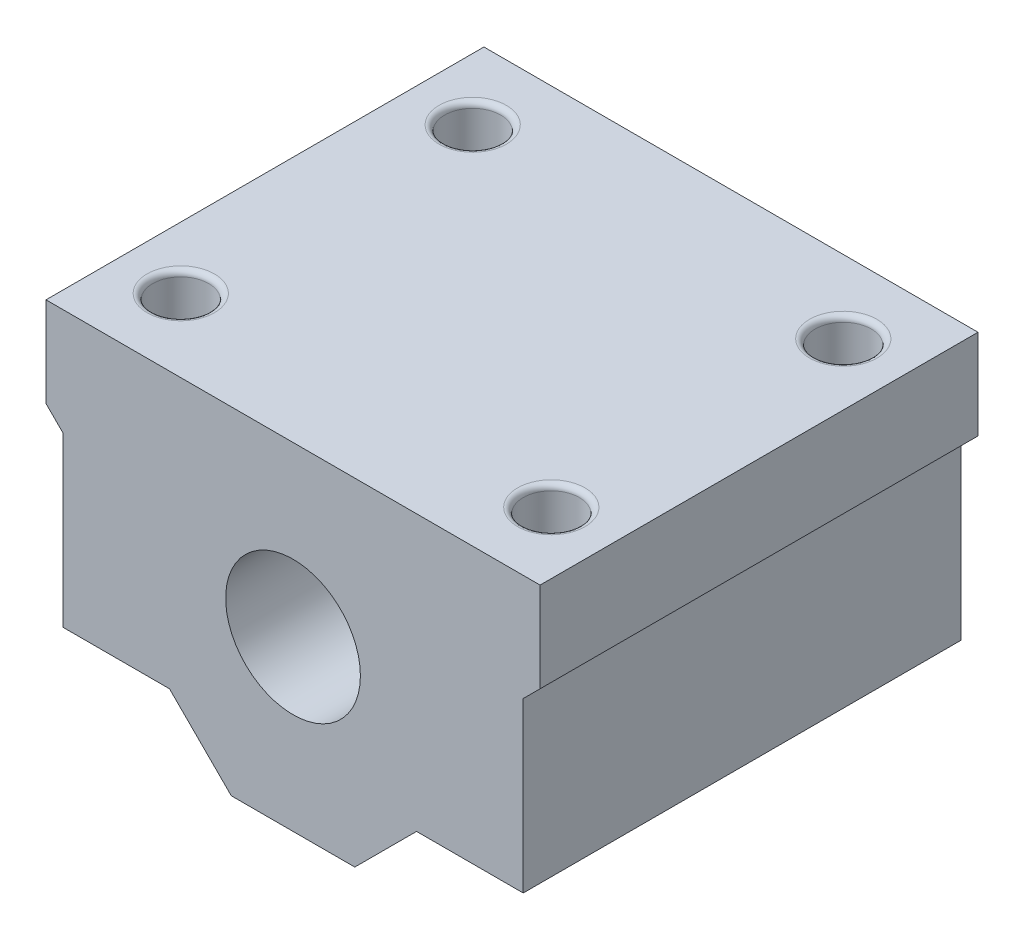
from build123d import *

# Parameters (mm, degrees)
IZIM2_R                     = 6
Y_KSEKLIK_EKSTR_ZYON1_DEPTH = 39
IZIM3_R                     = 2.5
KES_EKSTR_ZYON1_DEPTH       = 39
PAH2_SIZE                   = 1.5
FILLET2_R                   = 0.5


with BuildPart() as part:
    # Çizim2 → Yükseklik-Ekstrüzyon1 (new body)
    with BuildSketch(Plane.XY):
        Polygon((22, 15), (-22, 15), (-22, 7), (-20.5, 5.5), (-20.5, -9.5), (-11, -9.5), (-5.5, -15), (5.5, -15), (11, -9.5), (20.5, -9.5), (20.5, 5.5), (22, 7), align=None)
        Circle(IZIM2_R, mode=Mode.SUBTRACT)
    extrude(amount=Y_KSEKLIK_EKSTR_ZYON1_DEPTH)

    # Çizim3 → Kes-Ekstrüzyon1 (cut)
    with BuildSketch(Plane.XZ.offset(9.5)):
        with Locations((16.5, 32.5)):
            Circle(IZIM3_R)
        with Locations((-16.5, 32.5)):
            Circle(IZIM3_R)
        with Locations((-16.5, 6.5)):
            Circle(IZIM3_R)
        with Locations((16.5, 6.5)):
            Circle(IZIM3_R)
    extrude(amount=-KES_EKSTR_ZYON1_DEPTH, mode=Mode.SUBTRACT)

    # Pah2
    pah2_edges = [part.edges().sort_by_distance(p)[0] for p in [
        (-6, 0, 0),
    ]]
    chamfer(pah2_edges, length=PAH2_SIZE)

    # Fillet2
    fillet2_edges = [part.edges().sort_by_distance(p)[0] for p in [
        (14, 15, 32.5),
        (14, 15, 6.5),
        (-19, 15, 6.5),
        (-19, 15, 32.5),
    ]]
    fillet(fillet2_edges, radius=FILLET2_R)


solid = part.part
